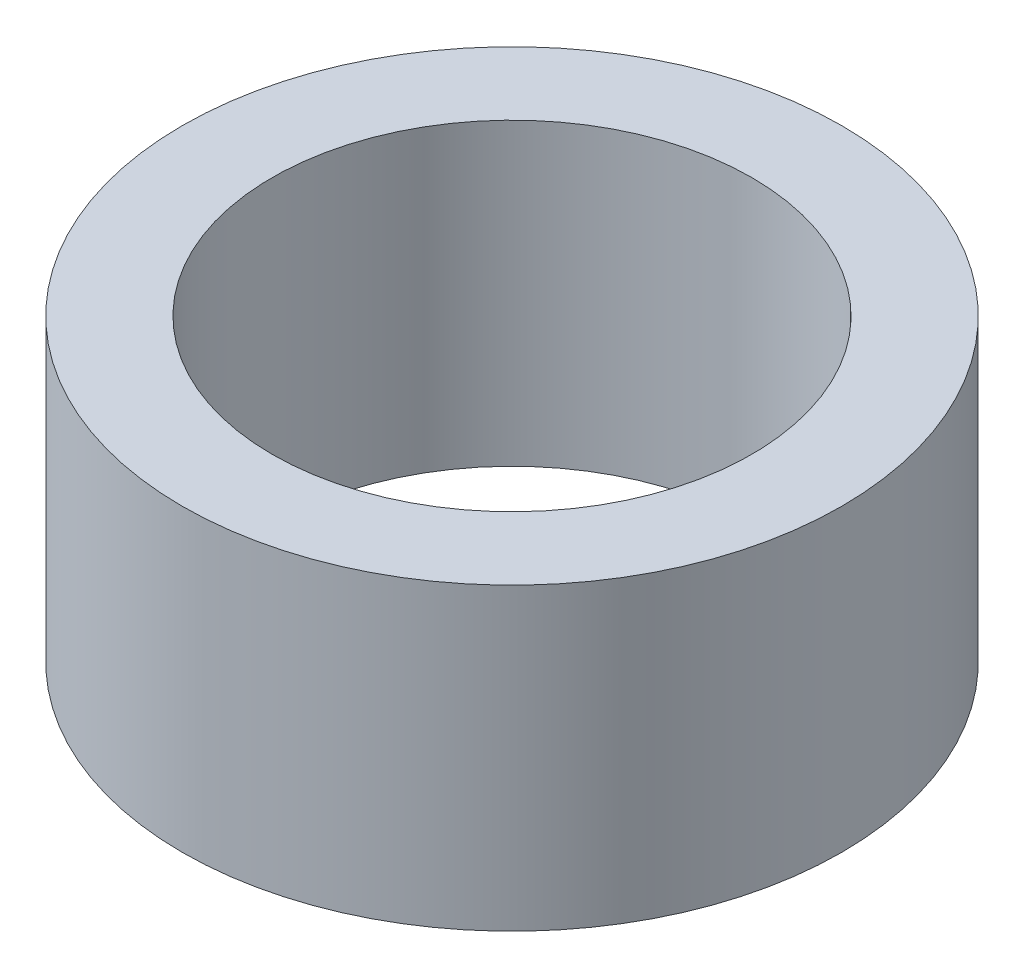
from build123d import *

# Parameters (mm, degrees)
ESQUISSE1_R        = 2.2
ESQUISSE1_R_2      = 1.6
BOSS_EXTRU_1_DEPTH = 2


with BuildPart() as part:
    # Esquisse1 → Boss.-Extru.1 (new body)
    with BuildSketch(Plane(origin=(0, 0, 0), x_dir=(1, 0, 0), z_dir=(0, 1, 0))):
        with Locations(Location((0, 0, 0), (0, 0, 270))):
            Circle(ESQUISSE1_R)
        with Locations(Location((0, 0, 0), (0, 0, 270))):
            Circle(ESQUISSE1_R_2, mode=Mode.SUBTRACT)
    extrude(amount=BOSS_EXTRU_1_DEPTH)


solid = part.part
